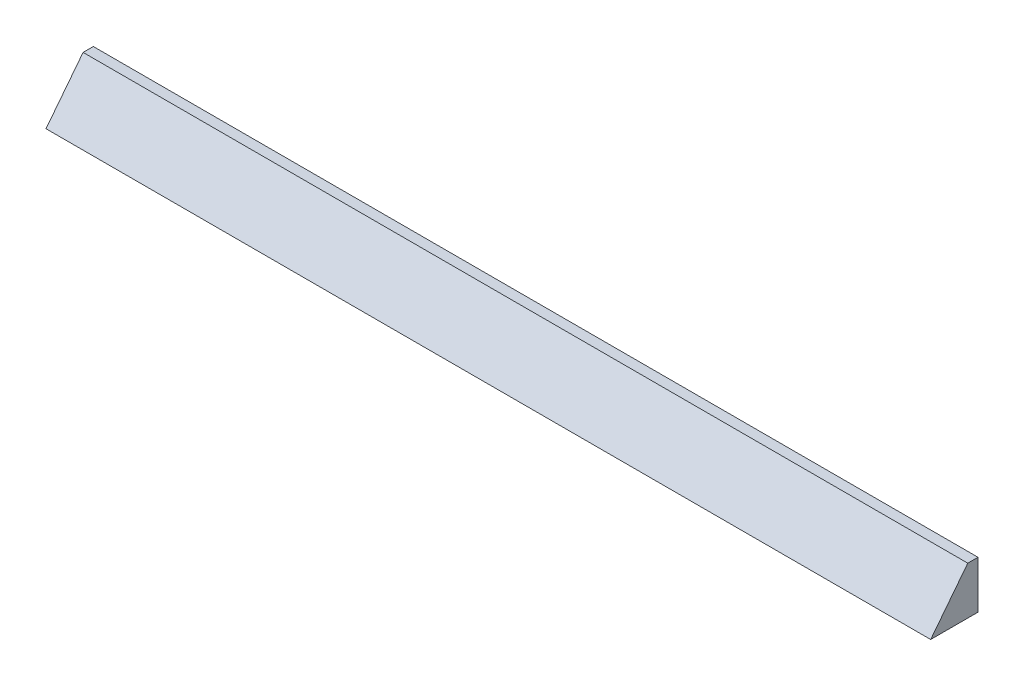
from build123d import *

# Parameters (mm, degrees)
RESSALTO_EXTRUS_O15_DEPTH = 93


with BuildPart() as part:
    # Esboço59 → Ressalto-extrusão15 (new body)
    with BuildSketch(Plane.ZY.offset(-55.189074272)):
        Polygon((38, 1.330545809), (38, -3.669454191), (42.974195121, -3.669454191), (39.075082585, 1.330545809), align=None)
    extrude(amount=RESSALTO_EXTRUS_O15_DEPTH)


solid = part.part
